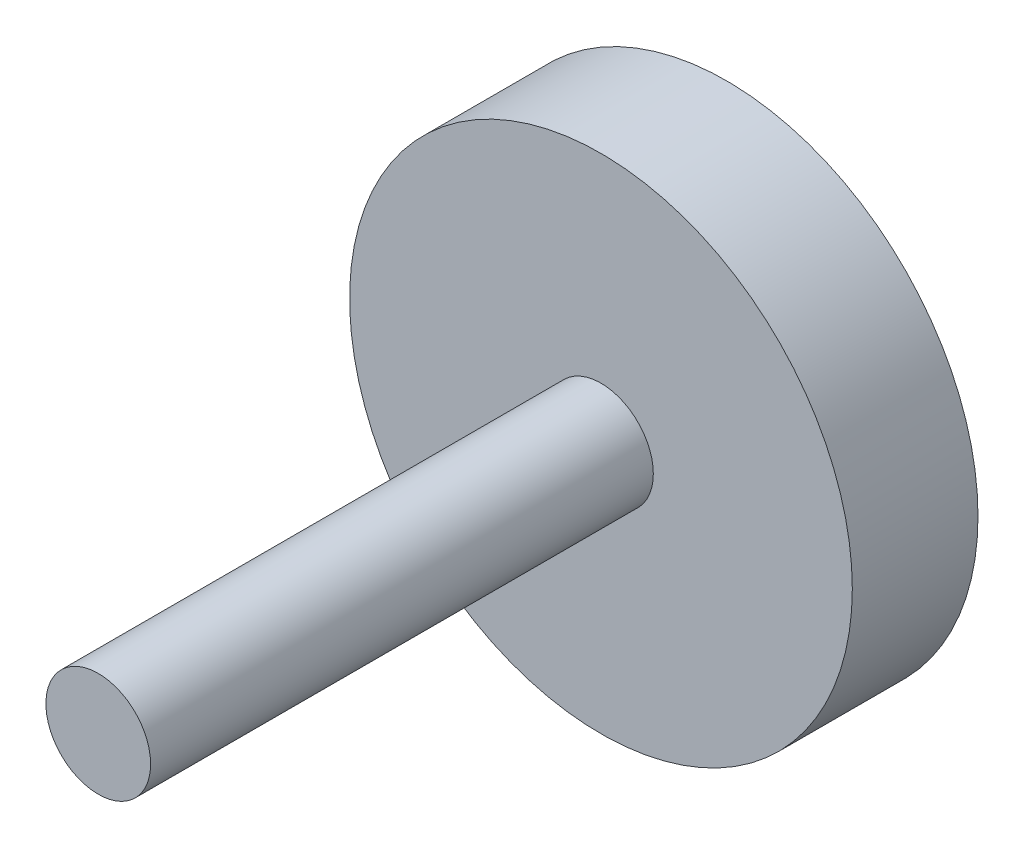
from build123d import *

# Parameters (mm, degrees)
SKETCH1_R           = 20
BOSS_EXTRUDE1_DEPTH = 10
SKETCH2_R           = 4.1656
BOSS_EXTRUDE2_DEPTH = 40


with BuildPart() as part:
    # Sketch1 → Boss-Extrude1 (new body)
    with BuildSketch(Plane(origin=(0, 0, 0), x_dir=(0, 1, 0), z_dir=(0, 0, 1))):
        with Locations(Location((0, 0, 0), (0, 0, 270))):
            Circle(SKETCH1_R)
    extrude(amount=BOSS_EXTRUDE1_DEPTH)

    # Sketch2 → Boss-Extrude2 (add)
    with BuildSketch(Plane.XY.offset(10)):
        Circle(SKETCH2_R)
    extrude(amount=BOSS_EXTRUDE2_DEPTH)


solid = part.part
